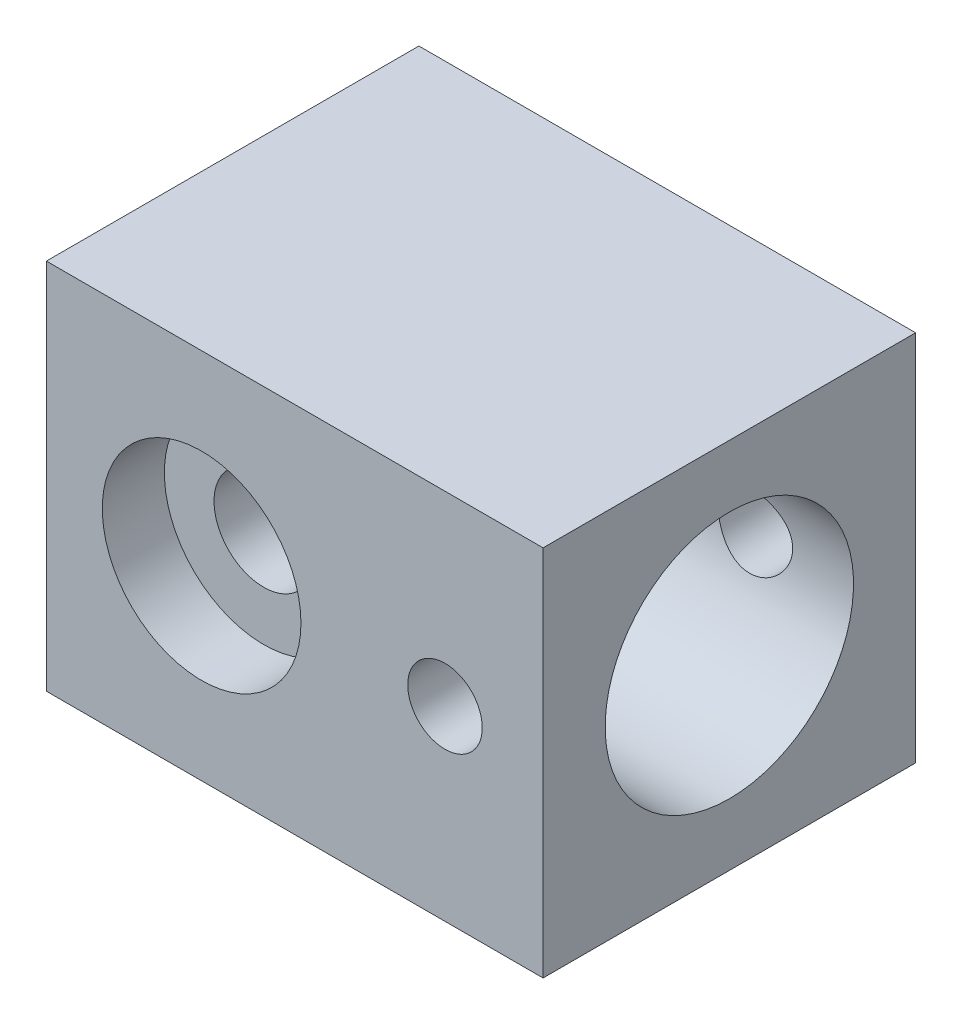
from build123d import *

# Parameters (mm, degrees)
SKETCH9_W           = 40
SKETCH9_H           = 30
BOSS_EXTRUDE2_DEPTH = 30
SKETCH10_R          = 10
CUT_EXTRUDE1_DEPTH  = 15
SKETCH11_R          = 8
SKETCH11_R_2        = 4
CUT_EXTRUDE2_DEPTH  = 5
SKETCH11_3_R        = 4
CUT_EXTRUDE3_DEPTH  = 101
SKETCH12_R          = 3
CUT_EXTRUDE4_DEPTH  = 101


with BuildPart() as part:
    # Sketch9 → Boss-Extrude2 (new body)
    with BuildSketch(Plane.XY):
        with Locations((20, -15)):
            Rectangle(SKETCH9_W, SKETCH9_H)
    extrude(amount=BOSS_EXTRUDE2_DEPTH)

    # Sketch10 → Cut-Extrude1 (cut)
    with BuildSketch(Plane(origin=(40, 0, 0), x_dir=(0, 0, -1), z_dir=(1, 0, 0))):
        with Locations((-15, -15)):
            Circle(SKETCH10_R)
    extrude(amount=-CUT_EXTRUDE1_DEPTH, mode=Mode.SUBTRACT)

    # Sketch11 → Cut-Extrude2 (cut)
    with BuildSketch(Plane.XY.offset(30)):
        with Locations((12.5, -15)):
            Circle(SKETCH11_R)
        with Locations((12.5, -15)):
            Circle(SKETCH11_R_2, mode=Mode.SUBTRACT)
    cut_extrude2 = extrude(amount=-CUT_EXTRUDE2_DEPTH, mode=Mode.SUBTRACT)

    # Sketch11<3> → Cut-Extrude3 (cut)
    with BuildSketch(Plane.XY.offset(30)):
        with Locations((12.5, -15)):
            Circle(SKETCH11_3_R)
    extrude(amount=-CUT_EXTRUDE3_DEPTH, mode=Mode.SUBTRACT)

    # Sketch12 → Cut-Extrude4 (cut)
    with BuildSketch(Plane.XY.offset(30)):
        with Locations((32.1, -15)):
            Circle(SKETCH12_R)
    extrude(amount=-CUT_EXTRUDE4_DEPTH, mode=Mode.SUBTRACT)

    # Mirror1: Cut-Extrude2 across plane
    add(cut_extrude2.mirror(Plane(origin=(0, 0, 15), x_dir=(1, 0, 0), z_dir=(0, 0, -1))), mode=Mode.SUBTRACT)


solid = part.part
